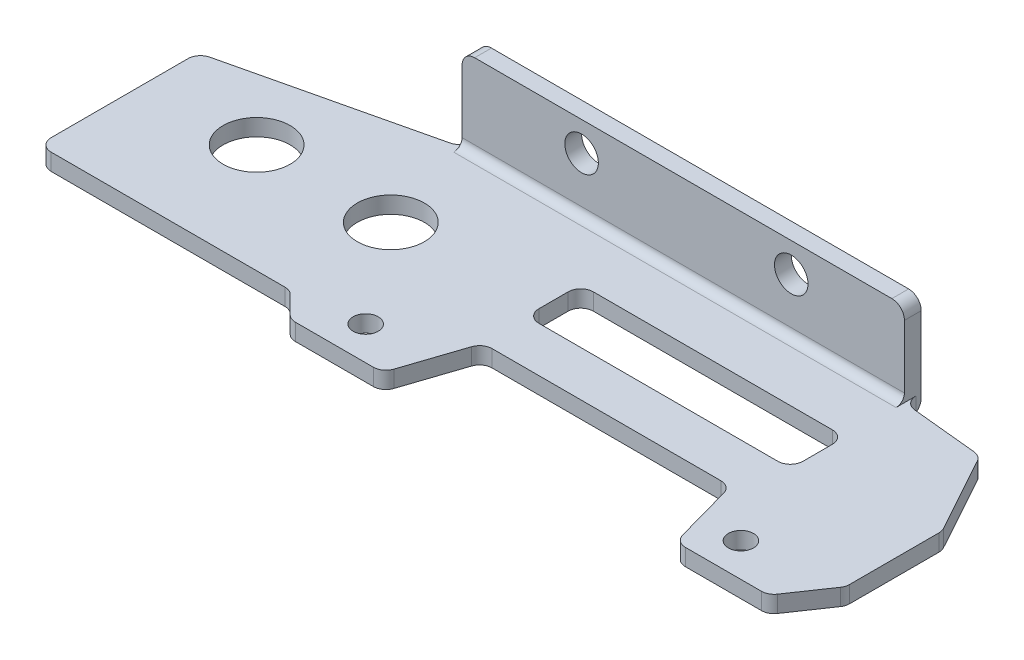
from build123d import *

# Parameters (mm, degrees)
SKETCH1_R           = 1.5
SKETCH1_R_2         = 4
SKETCH1_W           = 31.5
SKETCH1_H           = 6.5
BOSS_EXTRUDE1_DEPTH = 2
SKETCH2_W           = 52.75
SKETCH2_H           = 2
BOSS_EXTRUDE2_DEPTH = 10
SKETCH3_R           = 2
CUT_EXTRUDE1_DEPTH  = 100.1617996
FILLET1_R           = 1.5
FILLET2_R           = 1
FILLET3_R           = 1.5


with BuildPart() as part:
    # Sketch1 → Boss-Extrude1 (new body)
    with BuildSketch(Plane(origin=(0, 0, 0), x_dir=(1, 0, 0), z_dir=(0, 1, 0))):
        Polygon((0, 5.6), (30, 5.6), (33, 2.6), (44, 2.6), (47, 11.6), (76.5, 11.6), (79, 2.6), (90, 2.6), (93.75, 8.1), (93.75, 19.6), (88.25, 29.6), (78.25, 30.6), (78.25, 32.6), (25.5, 32.6), (25.5, 30.6), (0, 24.6), align=None)
        with Locations(Location((82.75, 6.6, 0), (0, 0, 270))):
            Circle(SKETCH1_R, mode=Mode.SUBTRACT)
        with Locations(Location((38, 6.6, 0), (0, 0, 270))):
            Circle(SKETCH1_R, mode=Mode.SUBTRACT)
        with Locations(Location((13, 18.6, 0), (0, 0, 270))):
            Circle(SKETCH1_R_2, mode=Mode.SUBTRACT)
        with Locations(Location((29, 18.6, 0), (0, 0, 270))):
            Circle(SKETCH1_R_2, mode=Mode.SUBTRACT)
        with Locations((62.5, 20.25)):
            Rectangle(SKETCH1_W, SKETCH1_H, mode=Mode.SUBTRACT)
    extrude(amount=BOSS_EXTRUDE1_DEPTH)

    # Sketch2 → Boss-Extrude2 (add)
    with BuildSketch(Plane(origin=(0, 2, 0), x_dir=(1, 0, 0), z_dir=(0, 1, 0))):
        with Locations((51.875, 31.6)):
            Rectangle(SKETCH2_W, SKETCH2_H)
    extrude(amount=BOSS_EXTRUDE2_DEPTH)

    # Sketch3 → Cut-Extrude1 (cut, through all)
    with BuildSketch(Plane(origin=(0, 0, -32.6), x_dir=(-1, 0, 0), z_dir=(0, 0, -1))):
        with Locations((-64.75, 8.5)):
            Circle(SKETCH3_R)
        with Locations((-39.75, 8.5)):
            Circle(SKETCH3_R)
    extrude(amount=-CUT_EXTRUDE1_DEPTH, mode=Mode.SUBTRACT)

    # Fillet1
    fillet1_edges = [part.edges().sort_by_distance(p)[0] for p in [
        (46.75, 1, -17),
        (46.75, 1, -23.5),
        (0, 1, -24.6),
        (25.5, 1, -30.6),
        (25.5, 12, -31.6),
        (78.25, 1, -17),
        (78.25, 1, -23.5),
        (0, 1, -5.6),
        (30, 1, -5.6),
        (33, 1, -2.6),
        (44, 1, -2.6),
        (47, 1, -11.6),
        (76.5, 1, -11.6),
        (79, 1, -2.6),
        (90, 1, -2.6),
        (93.75, 1, -8.1),
        (93.75, 1, -19.6),
        (88.25, 1, -29.6),
        (78.25, 1, -30.6),
        (78.25, 12, -31.6),
    ]]
    fillet(fillet1_edges, radius=FILLET1_R)

    # Fillet2
    fillet2_edges = [part.edges().sort_by_distance(p)[0] for p in [
        (51.875, 2, -30.6),
    ]]
    fillet(fillet2_edges, radius=FILLET2_R)

    # Fillet3
    fillet3_edges = [part.edges().sort_by_distance(p)[0] for p in [
        (51.875, 0, -32.6),
    ]]
    fillet(fillet3_edges, radius=FILLET3_R)


solid = part.part
